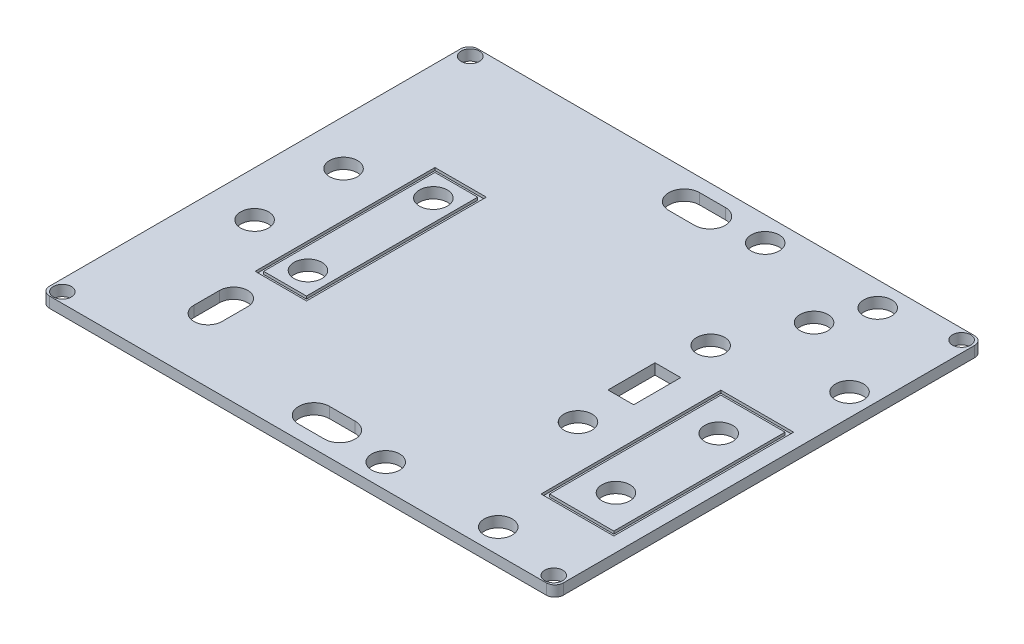
from build123d import *

# Parameters (mm, degrees)
SKETCH1_W               = 152.4
SKETCH1_H               = 127
BOSS_EXTRUDE1_DEPTH     = 3.175
FILLET1_R               = 2.54
SKETCH9_R               = 4.15
CUT_EXTRUDE8_DEPTH      = 100.240972511
CUT_EXTRUDE11_DEPTH     = 100.240972511
CUT_EXTRUDE12_DEPTH     = 100.240972511
SKETCH15_R              = 4.15
CUT_EXTRUDE13_DEPTH     = 100.240972511
SKETCH16_R              = 4.15
CUT_EXTRUDE14_DEPTH     = 100.240972511
SKETCH17_R              = 2.69
CUT_EXTRUDE16_DEPTH     = 100.240972511
MIRROR7_COPY_1_SKETCH_R = 2.69
MIRROR7_COPY_1_DEPTH    = 100.240972511
SKETCH18_R              = 4.15
CUT_EXTRUDE17_DEPTH     = 100.240972511
SKETCH19_R              = 4.15
CUT_EXTRUDE18_DEPTH     = 100.240972511
SKETCH20_R              = 4.15
CUT_EXTRUDE19_DEPTH     = 100.240972511
SKETCH21_W              = 7.62
SKETCH21_H              = 13.958580006
CUT_EXTRUDE20_DEPTH     = 100.240972511
SKETCH22_W              = 15.228595593
SKETCH22_H              = 53.32954849
SKETCH22_W_2            = 12.7
SKETCH22_H_2            = 50.8
CUT_EXTRUDE21_DEPTH     = 0.79375
SKETCH24_W              = 21.59
SKETCH24_H              = 53.34
SKETCH24_W_2            = 19.05
SKETCH24_H_2            = 50.8
CUT_EXTRUDE24_DEPTH     = 0.79375


with BuildPart() as part:
    # Sketch1 → Boss-Extrude1 (new body)
    with BuildSketch(Plane(origin=(0, 0, 0), x_dir=(1, 0, 0), z_dir=(0, 1, 0))):
        Rectangle(SKETCH1_W, SKETCH1_H)
    extrude(amount=BOSS_EXTRUDE1_DEPTH)

    # Fillet1
    fillet1_edges = [part.edges().sort_by_distance(p)[0] for p in [
        (76.2, 1.5875, 63.5),
        (-76.2, 1.5875, 63.5),
        (-76.2, 1.5875, -63.5),
        (76.2, 1.5875, -63.5),
    ]]
    fillet(fillet1_edges, radius=FILLET1_R)

    # Sketch9 → Cut-Extrude8 (cut, through all)
    with BuildSketch(Plane.XZ):
        with Locations(Location((60.8584, 30.027977178, 0), (0, 0, 270))):
            Circle(SKETCH9_R)
        with Locations(Location((60.8584, -0.452022822, 0), (0, 0, 270))):
            Circle(SKETCH9_R)
    extrude(amount=-CUT_EXTRUDE8_DEPTH, mode=Mode.SUBTRACT)

    # Sketch12 → Cut-Extrude11 (cut, through all)
    with BuildSketch(Plane.XZ):
        with BuildLine():
            Line((-3.81, 59.465627528), (3.81, 59.465627528))
            ThreePointArc((3.81, 59.465627528), (8.387405636, 54.888221892), (3.81, 50.310816255))
            Line((3.81, 50.310816255), (-3.81, 50.310816255))
            ThreePointArc((-3.81, 50.310816255), (-8.387405636, 54.888221892), (-3.81, 59.465627528))
        make_face()
    cut_extrude11 = extrude(amount=-CUT_EXTRUDE11_DEPTH, mode=Mode.SUBTRACT)

    # Mirror3: Cut-Extrude11 across plane
    add(cut_extrude11.mirror(Plane.XY), mode=Mode.SUBTRACT)

    # Sketch13 → Cut-Extrude12 (cut, through all)
    with BuildSketch(Plane(origin=(0, 0, 0), x_dir=(-1, 0, 0), z_dir=(0, -1, 0))):
        with BuildLine():
            Line((49.892874771, -36.83), (49.892874771, -44.45))
            ThreePointArc((49.892874771, -44.45), (45.72, -48.622874771), (41.547125229, -44.45))
            Line((41.547125229, -44.45), (41.547125229, -36.83))
            ThreePointArc((41.547125229, -36.83), (45.72, -32.657125229), (49.892874771, -36.83))
        make_face()
    extrude(amount=-CUT_EXTRUDE12_DEPTH, mode=Mode.SUBTRACT)

    # Sketch15 → Cut-Extrude13 (cut, through all)
    with BuildSketch(Plane(origin=(0, 0, 0), x_dir=(-1, 0, 0), z_dir=(0, -1, 0))):
        with Locations(Location((41.916131811, 18.596838804, 0), (0, 0, 90))):
            Circle(SKETCH15_R)
        with Locations(Location((41.916131811, -18.596838804, 0), (0, 0, 90))):
            Circle(SKETCH15_R)
    extrude(amount=-CUT_EXTRUDE13_DEPTH, mode=Mode.SUBTRACT)

    # Sketch16 → Cut-Extrude14 (cut, through all)
    with BuildSketch(Plane(origin=(0, 0, 0), x_dir=(-1, 0, 0), z_dir=(0, -1, 0))):
        with Locations(Location((-69.599893995, 30.499477113, 0), (0, 0, 90))):
            Circle(SKETCH16_R)
        with Locations(Location((-46.522565834, 43.05939533, 0), (0, 0, 90))):
            Circle(SKETCH16_R)
    extrude(amount=-CUT_EXTRUDE14_DEPTH, mode=Mode.SUBTRACT)

    # Sketch17 → Cut-Extrude16 (cut, through all)
    with BuildSketch(Plane.XZ):
        with Locations(Location((72.867806522, 60.482193478, 0), (0, 0, 270))):
            Circle(SKETCH17_R)
    cut_extrude16 = extrude(amount=-CUT_EXTRUDE16_DEPTH, mode=Mode.SUBTRACT)

    # Mirror6: Cut-Extrude16 across plane
    add(cut_extrude16.mirror(Plane(origin=(0, 0, 0), x_dir=(0, 0, 1), z_dir=(1, 0, 0))), mode=Mode.SUBTRACT)

    # Mirror7: Cut-Extrude16 across plane
    add(cut_extrude16.mirror(Plane.XY), mode=Mode.SUBTRACT)

    # Mirror7 copy 1 sketch → Mirror7 copy 1 (cut, through all)
    with BuildSketch(Plane(origin=(0, 0, 0), x_dir=(-1, 0, 0), z_dir=(0, -1, 0))):
        with Locations(Location((72.867806522, 60.482193478, 0), (0, 0, 270))):
            Circle(MIRROR7_COPY_1_SKETCH_R)
    extrude(amount=-MIRROR7_COPY_1_DEPTH, mode=Mode.SUBTRACT)

    # Sketch18 → Cut-Extrude17 (cut, through all)
    with BuildSketch(Plane(origin=(0, 3.175, 0), x_dir=(1, 0, 0), z_dir=(0, 1, 0))):
        with Locations(Location((37.078939717, 21.853932791, 0), (0, 0, 270))):
            Circle(SKETCH18_R)
        with Locations(Location((37.078939717, -17.508548393, 0), (0, 0, 270))):
            Circle(SKETCH18_R)
    extrude(amount=-CUT_EXTRUDE17_DEPTH, mode=Mode.SUBTRACT)

    # Sketch19 → Cut-Extrude18 (cut, through all)
    with BuildSketch(Plane(origin=(0, 3.175, 0), x_dir=(1, 0, 0), z_dir=(0, 1, 0))):
        with Locations(Location((52.190187574, -56.270763327, 0), (0, 0, 270))):
            Circle(SKETCH19_R)
        with Locations(Location((18.821046034, -56.270763327, 0), (0, 0, 270))):
            Circle(SKETCH19_R)
    cut_extrude18 = extrude(amount=-CUT_EXTRUDE18_DEPTH, mode=Mode.SUBTRACT)

    # Sketch20 → Cut-Extrude19 (cut, through all)
    with BuildSketch(Plane(origin=(0, 3.175, 0), x_dir=(1, 0, 0), z_dir=(0, 1, 0))):
        with Locations(Location((-62.798787331, 12.836349908, 0), (0, 0, 270))):
            Circle(SKETCH20_R)
        with Locations(Location((-62.798787331, -13.535650092, 0), (0, 0, 270))):
            Circle(SKETCH20_R)
    extrude(amount=-CUT_EXTRUDE19_DEPTH, mode=Mode.SUBTRACT)

    # Mirror8: Cut-Extrude18 across plane
    add(cut_extrude18.mirror(Plane.XY), mode=Mode.SUBTRACT)

    # Sketch21 → Cut-Extrude20 (cut, through all)
    with BuildSketch(Plane.XZ):
        with Locations((37.078939717, -2.172692199)):
            Rectangle(SKETCH21_W, SKETCH21_H)
    extrude(amount=-CUT_EXTRUDE20_DEPTH, mode=Mode.SUBTRACT)

    # Sketch22 → Cut-Extrude21 (cut)
    with BuildSketch(Plane(origin=(0, 3.175, 0), x_dir=(1, 0, 0), z_dir=(0, 1, 0))):
        with Locations((-41.904297797, 0.005225755)):
            Rectangle(SKETCH22_W, SKETCH22_H)
        with Locations((-41.91, 0)):
            Rectangle(SKETCH22_W_2, SKETCH22_H_2, mode=Mode.SUBTRACT)
    extrude(amount=-CUT_EXTRUDE21_DEPTH, mode=Mode.SUBTRACT)

    # Sketch24 → Cut-Extrude24 (cut)
    with BuildSketch(Plane(origin=(0, 3.175, 0), x_dir=(-1, 0, 0), z_dir=(0, -1, 0))):
        with Locations((-60.8584, -14.787977178)):
            Rectangle(SKETCH24_W, SKETCH24_H)
        with Locations((-60.8584, -14.787977178)):
            Rectangle(SKETCH24_W_2, SKETCH24_H_2, mode=Mode.SUBTRACT)
    extrude(amount=CUT_EXTRUDE24_DEPTH, mode=Mode.SUBTRACT)


solid = part.part
